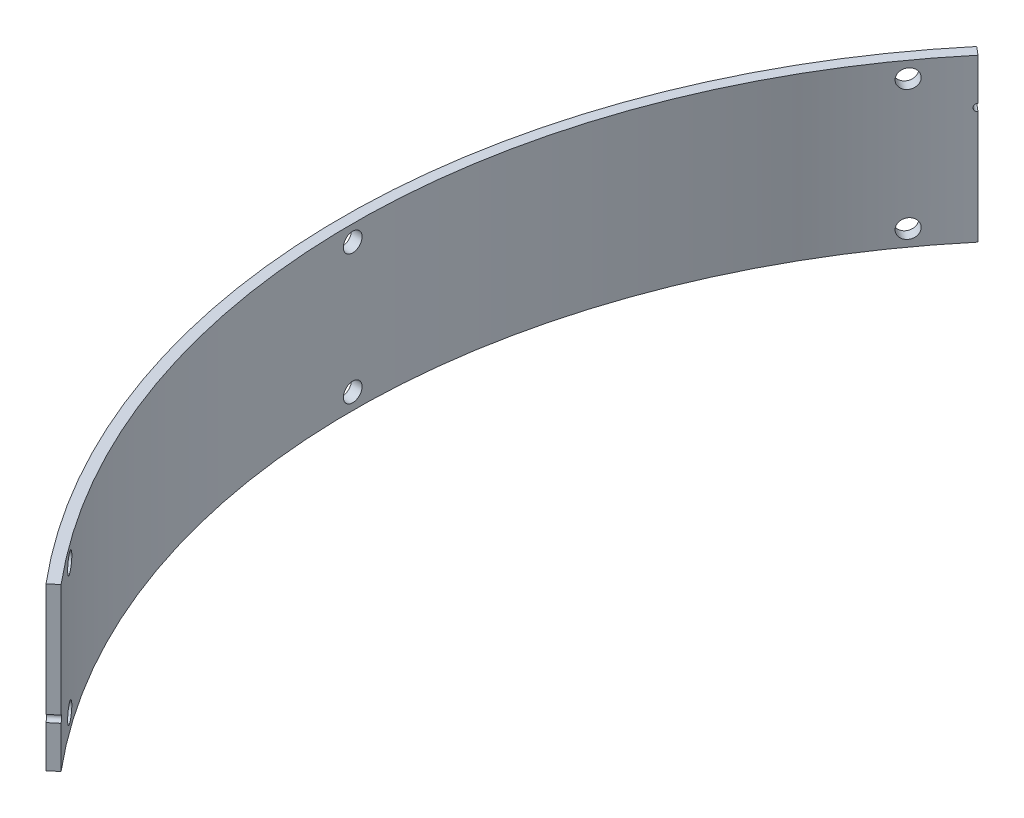
from build123d import *

# Parameters (mm, degrees)
SKETCH1_W                       = 1.5
SKETCH1_H                       = 22.7
REVOLVE1_ANGLE                  = 80
SKETCH2_R                       = 1.3125
CUT_EXTRUDE1_DEPTH              = 122.192879456
CIRPATTERN1_COUNT               = 2
CIRPATTERN1_ANGLE               = 36
CIRPATTERN1_THE_OTHER_WAY_COUNT = 2
CIRPATTERN1_THE_OTHER_WAY_ANGLE = 36
CUT_EXTRUDE2_DEPTH              = 133.380069744
CUT_EXTRUDE2_DEPTH_BACK         = 133.380069744
SKETCH3_R                       = 0.5
CUT_EXTRUDE3_DEPTH              = 133.380069744
CUT_EXTRUDE3_DEPTH_BACK         = 133.380069744
SKETCH4_R                       = 0.5


with BuildPart() as part:
    # Sketch1 → Revolve1 (revolve, symmetric)
    with BuildSketch(Plane.XY) as revolve1_sk:
        with Locations((-100.75, 0)):
            Rectangle(SKETCH1_W, SKETCH1_H)
    revolve(axis=Axis((0, -1000, 0), (0, 1, 0)), revolution_arc=REVOLVE1_ANGLE / 2)
    revolve(revolve1_sk.sketch, axis=Axis((0, -1000, 0), (0, -1, 0)), revolution_arc=REVOLVE1_ANGLE / 2)

    # Sketch2 → Cut-Extrude1 (cut, through all)
    with BuildSketch(Plane(origin=(0, 0, 0), x_dir=(0, 0, -1), z_dir=(1, 0, 0))):
        with Locations((0, -9.1)):
            Circle(SKETCH2_R)
        with Locations((0, 9.1)):
            Circle(SKETCH2_R)
    cut_extrude1 = extrude(amount=-CUT_EXTRUDE1_DEPTH, mode=Mode.SUBTRACT)

    # CirPattern1: Cut-Extrude1 ×2 about axis
    cirpattern1_axis = Axis((0, -1000, 0), (0, 1, 0))
    for i in range(1, CIRPATTERN1_COUNT):
        add(cut_extrude1.rotate(cirpattern1_axis, i * CIRPATTERN1_ANGLE / (CIRPATTERN1_COUNT - 1)), mode=Mode.SUBTRACT)

    # CirPattern1 the other way: Cut-Extrude1 ×2 about axis
    cirpattern1_the_other_way_axis = Axis((0, -1000, 0), (0, -1, 0))
    for i in range(1, CIRPATTERN1_THE_OTHER_WAY_COUNT):
        add(cut_extrude1.rotate(cirpattern1_the_other_way_axis, i * CIRPATTERN1_THE_OTHER_WAY_ANGLE / (CIRPATTERN1_THE_OTHER_WAY_COUNT - 1)), mode=Mode.SUBTRACT)

    # Sketch3 → Cut-Extrude2 (cut, two sides: drawn at the far end of the back side and taken through both)
    with BuildSketch(Plane(origin=(-76.604444312, 0, 64.278760969), x_dir=(-0.6427876096865407, 0, -0.7660444431189769), z_dir=(0.7660444431189769, -1.1789167470557806e-15, -0.6427876096865407)).offset(-CUT_EXTRUDE2_DEPTH_BACK)):
        with Locations((0, -5)):
            Circle(SKETCH3_R)
    extrude(amount=CUT_EXTRUDE2_DEPTH + CUT_EXTRUDE2_DEPTH_BACK, mode=Mode.SUBTRACT)

    # Sketch4 → Cut-Extrude3 (cut, two sides: drawn at the far end of the back side and taken through both)
    with BuildSketch(Plane(origin=(-76.604444312, 0, -64.278760969), x_dir=(-0.6427876096865405, 0, 0.7660444431189771), z_dir=(-0.7660444431189772, 0, -0.6427876096865405)).offset(-CUT_EXTRUDE3_DEPTH_BACK)):
        with Locations((-1e-09, 5)):
            Circle(SKETCH4_R)
    extrude(amount=CUT_EXTRUDE3_DEPTH + CUT_EXTRUDE3_DEPTH_BACK, mode=Mode.SUBTRACT)


solid = part.part
